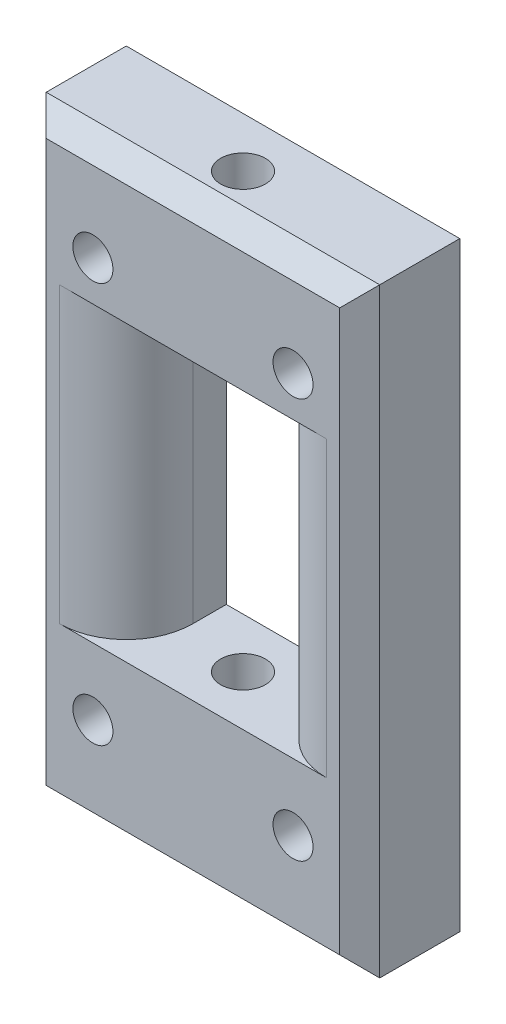
from build123d import *

# Parameters (mm, degrees)
SKETCH1_W           = 50
SKETCH1_H           = 90
SKETCH1_R           = 3
BOSS_EXTRUDE1_DEPTH = 15
SKETCH2_R           = 3.35
CUT_EXTRUDE1_DEPTH  = 155.757875405
CUT_EXTRUDE2_DEPTH  = 158.718102956
CHAMFER1_SIZE       = 3
FILLET1_R           = 10


with BuildPart() as part:
    # Sketch1 → Boss-Extrude1 (new body)
    with BuildSketch(Plane.XY):
        with Locations((100, 50)):
            Rectangle(SKETCH1_W, SKETCH1_H)
        with Locations((115, 20)):
            Circle(SKETCH1_R, mode=Mode.SUBTRACT)
        with Locations((85, 20)):
            Circle(SKETCH1_R, mode=Mode.SUBTRACT)
        with Locations((115, 80)):
            Circle(SKETCH1_R, mode=Mode.SUBTRACT)
        with Locations((85, 80)):
            Circle(SKETCH1_R, mode=Mode.SUBTRACT)
    extrude(amount=BOSS_EXTRUDE1_DEPTH)

    # Sketch2 → Cut-Extrude1 (cut, through all)
    with BuildSketch(Plane(origin=(0, 95, 0), x_dir=(1, 0, 0), z_dir=(0, 1, 0))):
        with Locations(Location((100, -7.5, 0), (0, 0, 270))):
            Circle(SKETCH2_R)
    extrude(amount=-CUT_EXTRUDE1_DEPTH, mode=Mode.SUBTRACT)

    # Sketch3 → Cut-Extrude2 (cut, through all)
    with BuildSketch(Plane.XY.offset(15)):
        Polygon((90, 70), (90, 74), (110, 74), (110, 70), (110, 30), (90, 30), align=None)
    extrude(amount=-CUT_EXTRUDE2_DEPTH, mode=Mode.SUBTRACT)

    # Chamfer1
    chamfer1_edges = [part.edges().sort_by_distance(p)[0] for p in [
        (75, 50, 15),
        (100, 5, 15),
        (125, 50, 15),
        (100, 95, 15),
    ]]
    chamfer(chamfer1_edges, length=CHAMFER1_SIZE)

    # Fillet1
    fillet1_edges = [part.edges().sort_by_distance(p)[0] for p in [
        (90, 52, 15),
        (110, 52, 15),
    ]]
    fillet(fillet1_edges, radius=FILLET1_R)


solid = part.part
